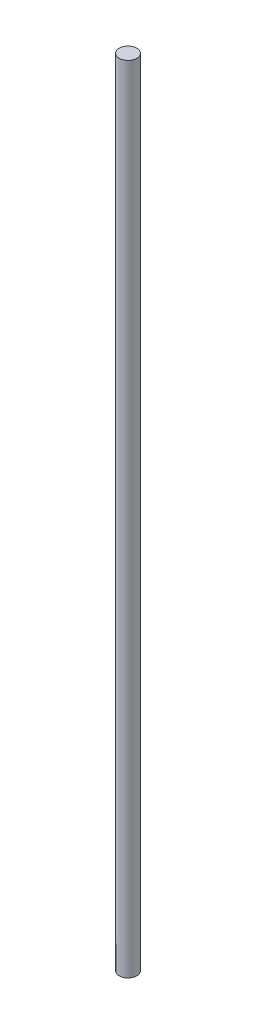
from build123d import *

# Parameters (mm, degrees)
CROQUIS1_R              = 1.5
SALIENTE_EXTRUIR1_DEPTH = 135


with BuildPart() as part:
    # Croquis1 → Saliente-Extruir1 (new body)
    with BuildSketch(Plane(origin=(-499.65369381, -70.001375325, -607.746407761), x_dir=(-0.9835282028968584, 1.7030197812727285e-15, 0.18075473467236286), z_dir=(0, 1, 0))):
        with Locations(Location((0, 0, 0), (0, 0, 349.586275958))):
            Circle(CROQUIS1_R)
    extrude(amount=SALIENTE_EXTRUIR1_DEPTH)


solid = part.part
